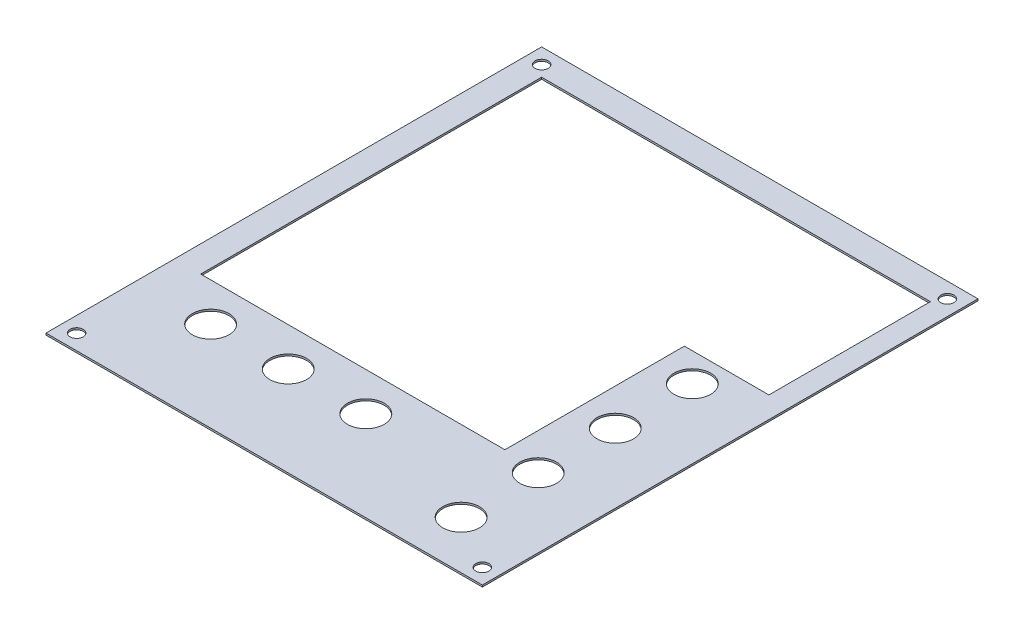
from build123d import *

# Parameters (mm, degrees)
SKETCH1_W           = 83.18
SKETCH1_H           = 94.48
SKETCH1_R           = 1.25
SKETCH1_R_2         = 3.5
BOSS_EXTRUDE1_DEPTH = 0.35


with BuildPart() as part:
    # Sketch1 → Boss-Extrude1 (new body)
    with BuildSketch(Plane(origin=(0, 0, 0), x_dir=(1, 0, 0), z_dir=(0, 1, 0))):
        with Locations((38.67, 44.32)):
            Rectangle(SKETCH1_W, SKETCH1_H)
        with Locations(Location((0, 88.64, 0), (0, 0, 270))):
            Circle(SKETCH1_R, mode=Mode.SUBTRACT)
        with Locations(Location((77.34, 88.64, 0), (0, 0, 270))):
            Circle(SKETCH1_R, mode=Mode.SUBTRACT)
        with Locations(Location((77.34, 0, 0), (0, 0, 270))):
            Circle(SKETCH1_R, mode=Mode.SUBTRACT)
        with Locations(Location((0, 0, 0), (0, 0, 270))):
            Circle(SKETCH1_R, mode=Mode.SUBTRACT)
        with Locations(Location((11.302, 14.24, 0), (0, 0, 270))):
            Circle(SKETCH1_R_2, mode=Mode.SUBTRACT)
        with Locations(Location((26.095, 14.24, 0), (0, 0, 270))):
            Circle(SKETCH1_R_2, mode=Mode.SUBTRACT)
        with Locations(Location((40.888, 14.24, 0), (0, 0, 270))):
            Circle(SKETCH1_R_2, mode=Mode.SUBTRACT)
        with Locations(Location((67.047, 6.248, 0), (0, 0, 270))):
            Circle(SKETCH1_R_2, mode=Mode.SUBTRACT)
        with Locations(Location((67.047, 20.938, 0), (0, 0, 270))):
            Circle(SKETCH1_R_2, mode=Mode.SUBTRACT)
        with Locations(Location((67.047, 35.628, 0), (0, 0, 270))):
            Circle(SKETCH1_R_2, mode=Mode.SUBTRACT)
        with Locations(Location((67.047, 50.318, 0), (0, 0, 270))):
            Circle(SKETCH1_R_2, mode=Mode.SUBTRACT)
        Polygon((2.08, 86.56), (60.08, 86.56), (76.192857175, 86.56), (76.192857175, 55.768), (60.08, 55.768), (60.08, 21.56), (2.08, 21.56), align=None, mode=Mode.SUBTRACT)
    extrude(amount=BOSS_EXTRUDE1_DEPTH)


solid = part.part
